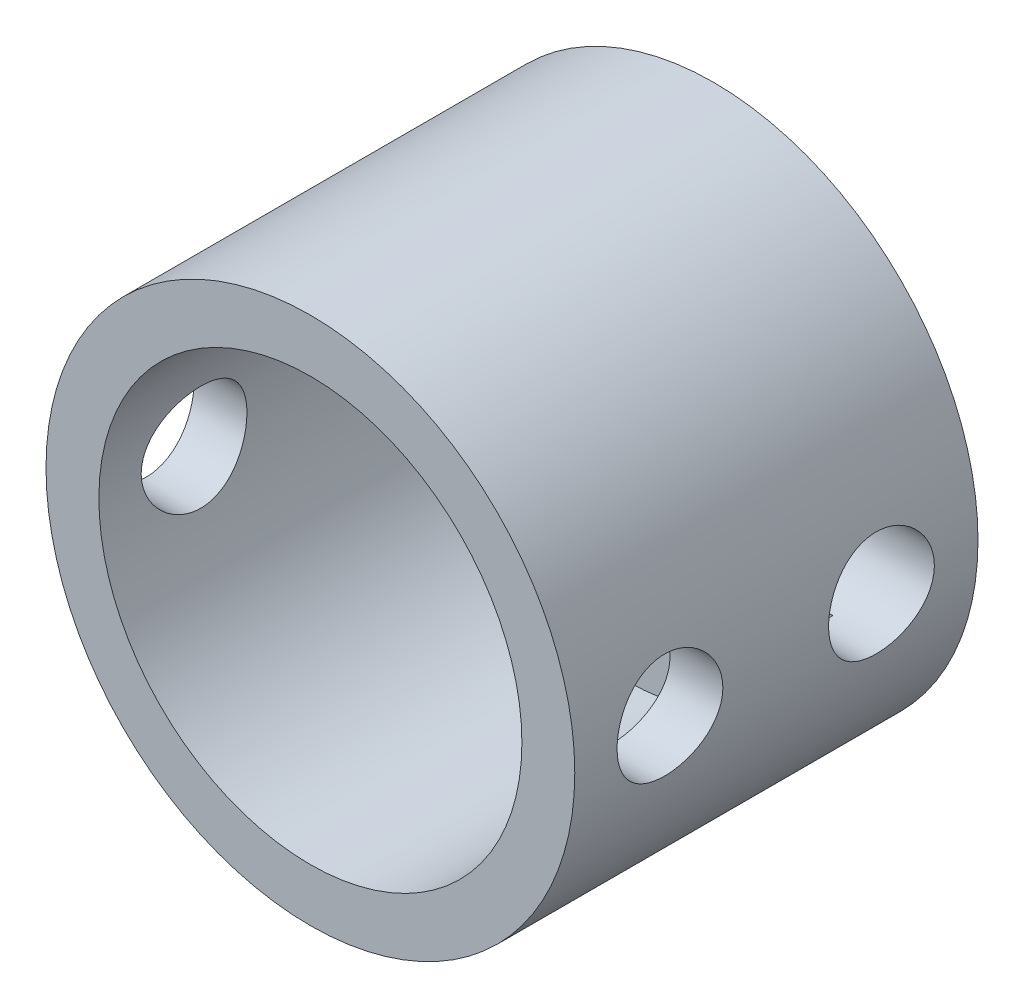
from build123d import *

# Parameters (mm, degrees)
ESBO_O1_R                  = 12.5
RESSALTO_EXTRUS_O1_DEPTH   = 4.064
ESBO_O2_R                  = 12.5
ESBO_O2_R_2                = 10
RESSALTO_EXTRUS_O2_DEPTH   = 15
CORTE_EXTRUS_O1_DEPTH      = 24
CORTE_EXTRUS_O1_DEPTH_BACK = 23
ESBO_O3_R                  = 2.5


with BuildPart() as part:
    # Esboço1 → Ressalto-extrusão1 (new body)
    with BuildSketch(Plane.XY):
        Circle(ESBO_O1_R)
    extrude(amount=RESSALTO_EXTRUS_O1_DEPTH)

    # Esboço2 → Ressalto-extrusão2 (add)
    with BuildSketch(Plane.XY.offset(4.064)):
        Circle(ESBO_O2_R)
        Circle(ESBO_O2_R_2, mode=Mode.SUBTRACT)
    extrude(amount=RESSALTO_EXTRUS_O2_DEPTH)

    # Esboço3 → Corte-extrusão1 (cut, two sides: drawn at the far end of the back side and taken through both)
    with BuildSketch(Plane(origin=(0, 0, 0), x_dir=(0, 0, -1), z_dir=(1, 0, 0)).offset(-CORTE_EXTRUS_O1_DEPTH_BACK)):
        with Locations(Location((-14.564, 0, 0), (0, 0, 180))):
            Circle(ESBO_O3_R)
        with Locations(Location((-4.564, 0, 0), (0, 0, 180))):
            Circle(ESBO_O3_R)
    extrude(amount=CORTE_EXTRUS_O1_DEPTH + CORTE_EXTRUS_O1_DEPTH_BACK, mode=Mode.SUBTRACT)


solid = part.part
